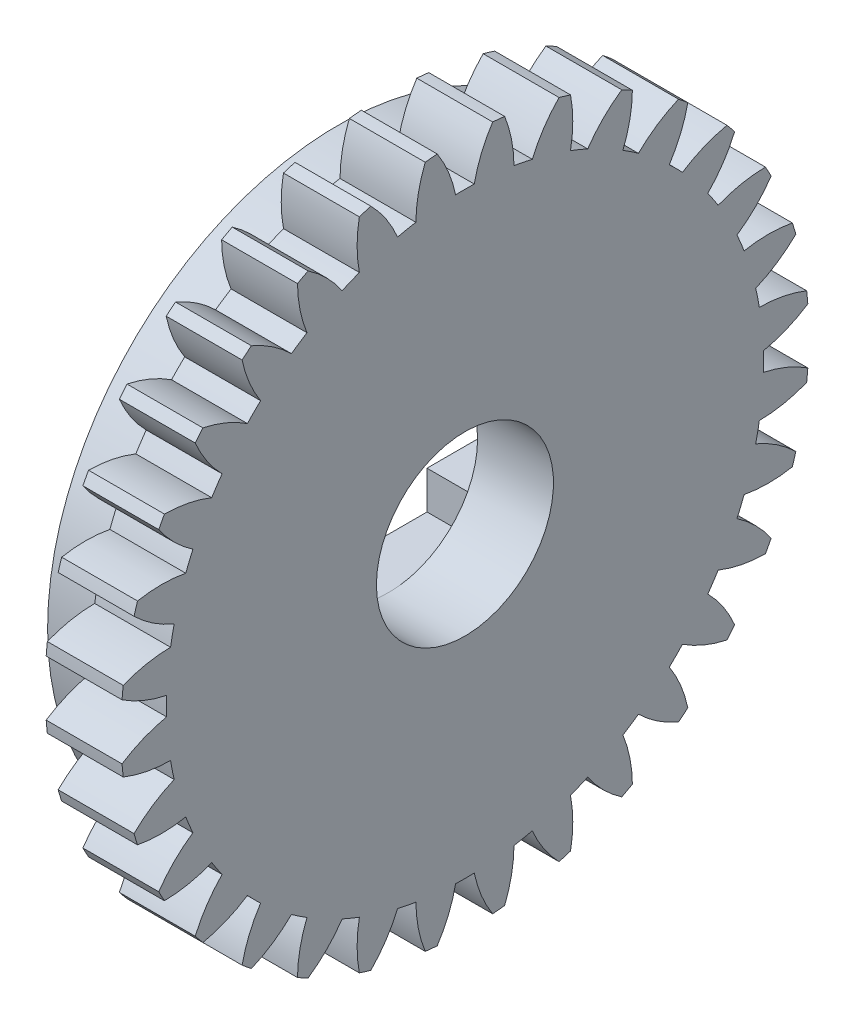
from build123d import *

# Parameters (mm, degrees)
BASPROSKE_W         = 3
BASPROSKE_H         = 13.6
TOOTHCUT_DEPTH      = 20.465867564
TEETHCUTS_COUNT     = 32
TEETHCUTS_ANGLE     = 348.75
BORSKE_R            = 0.5
BORE_DEPTH          = 50.0000508
SKETCH_2_R          = 11.5
EXTRUDE_1_DEPTH     = 2
CUT_EXTRUDE_1_DEPTH = 2
SKETCH_3_R          = 3.5
CUT_EXTRUDE_2_DEPTH = 20.404068244


with BuildPart() as part:
    # BasProSke → Base-Revolve (revolve)
    with BuildSketch(Plane(origin=(0, 0, 0), x_dir=(1, 0, 0), z_dir=(0, 1, 0))):
        with Locations((1.5, 6.8)):
            Rectangle(BASPROSKE_W, BASPROSKE_H)
    revolve(axis=Axis((-10, 0, 0), (1, 0, 0)))

    # TooCutSke → ToothCut (cut, through all)
    with BuildSketch(Plane(origin=(0, 0, 0), x_dir=(0, 0, -1), z_dir=(1, 0, 0))):
        with BuildLine():
            ThreePointArc((0.368942803, 11.793230355), (0, 11.799), (-0.368942803, 11.793230355))
            ThreePointArc((-0.368942803, 11.793230355), (-0.655209549, 12.722010195), (-1.111826967, 13.579961928))
            ThreePointArc((-1.111826967, 13.579961928), (0, 13.6254), (1.111826967, 13.579961928))
            ThreePointArc((1.111826967, 13.579961928), (0.655209549, 12.722010195), (0.368942803, 11.793230355))
        make_face()
    toothcut = extrude(amount=TOOTHCUT_DEPTH, mode=Mode.SUBTRACT)

    # TeethCuts: ToothCut ×32 about axis
    teethcuts_axis = Axis((-10, 0, 0), (1, 0, 0))
    for i in range(1, TEETHCUTS_COUNT):
        add(toothcut.rotate(teethcuts_axis, i * TEETHCUTS_ANGLE / (TEETHCUTS_COUNT - 1)), mode=Mode.SUBTRACT)

    # BorSke → Bore (cut, symmetric)
    with BuildSketch(Plane(origin=(0, 0, 0), x_dir=(0, 0, -1), z_dir=(1, 0, 0))):
        Circle(BORSKE_R)
    extrude(amount=BORE_DEPTH, both=True, mode=Mode.SUBTRACT)

    # 草图2 → 凸台-拉伸1 (add)
    with BuildSketch(Plane(origin=(0, 0, 0), x_dir=(0, 0, -1), z_dir=(1, 0, 0))):
        Circle(SKETCH_2_R)
    extrude(amount=-EXTRUDE_1_DEPTH)

    # 草图1 → 切除-拉伸1 (cut)
    with BuildSketch(Plane(origin=(-2, 0, 0), x_dir=(0, 0, -1), z_dir=(1, 0, 0))):
        with BuildLine():
            Line((3.5, 3.5), (-3.5, 3.5))
            Line((-3.5, 3.5), (-3.5, 2))
            Line((-3.5, 2), (-6.3, 2))
            ThreePointArc((-6.3, 2), (-8.3, 0), (-6.3, -2))
            Line((-6.3, -2), (-3.5, -2))
            Line((-3.5, -2), (-3.5, -3.5))
            Line((-3.5, -3.5), (3.5, -3.5))
            Line((3.5, -3.5), (3.5, -2))
            Line((3.5, -2), (6.3, -2))
            ThreePointArc((6.3, -2), (8.3, 0), (6.3, 2))
            Line((6.3, 2), (3.5, 2))
            Line((3.5, 2), (3.5, 3.5))
        make_face()
    extrude(amount=CUT_EXTRUDE_1_DEPTH, mode=Mode.SUBTRACT)

    # 草图3 → 切除-拉伸2 (cut, through all)
    with BuildSketch(Plane.ZY):
        Circle(SKETCH_3_R)
    extrude(amount=-CUT_EXTRUDE_2_DEPTH, mode=Mode.SUBTRACT)


solid = part.part
